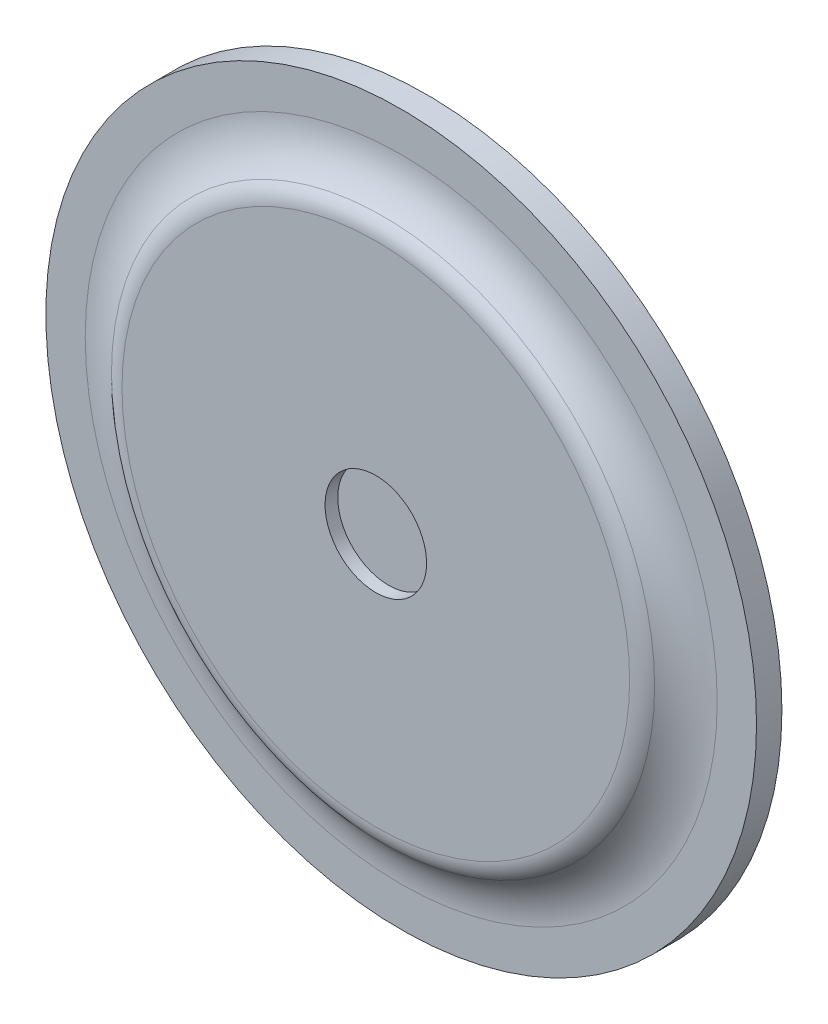
from build123d import *

# Parameters (mm, degrees)
SKETCH3_R          = 0.79375
CUT_EXTRUDE1_DEPTH = 1.5875


with BuildPart() as part:
    # Sketch1 → Revolve1 (revolve)
    with BuildSketch(Plane(origin=(0, 0, 0), x_dir=(0, 0, -1), z_dir=(1, 0, 0)), mode=Mode.PRIVATE) as revolve1_sk:
        with BuildLine():
            Line((-21.59, 0), (-21.59, 26.9875))
            Line((-21.59, 26.9875), (-25.4, 26.9875))
            Line((-25.4, 26.9875), (-25.4, 44.45))
            Line((-25.4, 44.45), (-28.575, 44.45))
            Line((-28.575, 44.45), (-28.575, 39.527129933))
            ThreePointArc((-28.575, 39.527129933), (-29.163802958, 36.527036929), (-30.842857143, 33.972037124))
            ThreePointArc((-30.842857143, 33.972037124), (-31.514478817, 32.950037202), (-31.75, 31.75))
            Line((-31.75, 31.75), (-31.75, 0))
            Line((-31.75, 0), (-21.59, 0))
        make_face()
    revolve(revolve1_sk.sketch.rotate(Axis((0, 0, 31.75), (0, 0, -1)), 90), axis=Axis((0, 0, 31.75), (0, 0, -1)))

    # Sketch2 → Cut-Revolve1 (revolve, cut)
    with BuildSketch(Plane(origin=(0, 0, 0), x_dir=(0, 0, -1), z_dir=(1, 0, 0)), mode=Mode.PRIVATE) as cut_revolve1_sk:
        Polygon((-30.1625, 25.4), (-23.1775, 25.4), (-23.1775, 0), (-31.75, 0), (-31.75, 6.35), (-30.1625, 6.35), align=None)
    revolve(cut_revolve1_sk.sketch.rotate(Axis((0, 0, 31.75), (0, 0, -1)), 180), axis=Axis((0, 0, 31.75), (0, 0, -1)), mode=Mode.SUBTRACT)

    # Sketch3 → Cut-Extrude1 (cut)
    with BuildSketch(Plane(origin=(0, 0, 21.59), x_dir=(-1, 0, 0), z_dir=(0, 0, -1))):
        with Locations((0, 3.175)):
            Circle(SKETCH3_R)
        with Locations((2.749630657, 1.5875)):
            Circle(SKETCH3_R)
        with Locations((2.749630657, -1.5875)):
            Circle(SKETCH3_R)
        with Locations((0, -3.175)):
            Circle(SKETCH3_R)
        with Locations((-2.749630657, -1.5875)):
            Circle(SKETCH3_R)
        with Locations((-2.749630657, 1.5875)):
            Circle(SKETCH3_R)
    extrude(amount=-CUT_EXTRUDE1_DEPTH, mode=Mode.SUBTRACT)


solid = part.part
